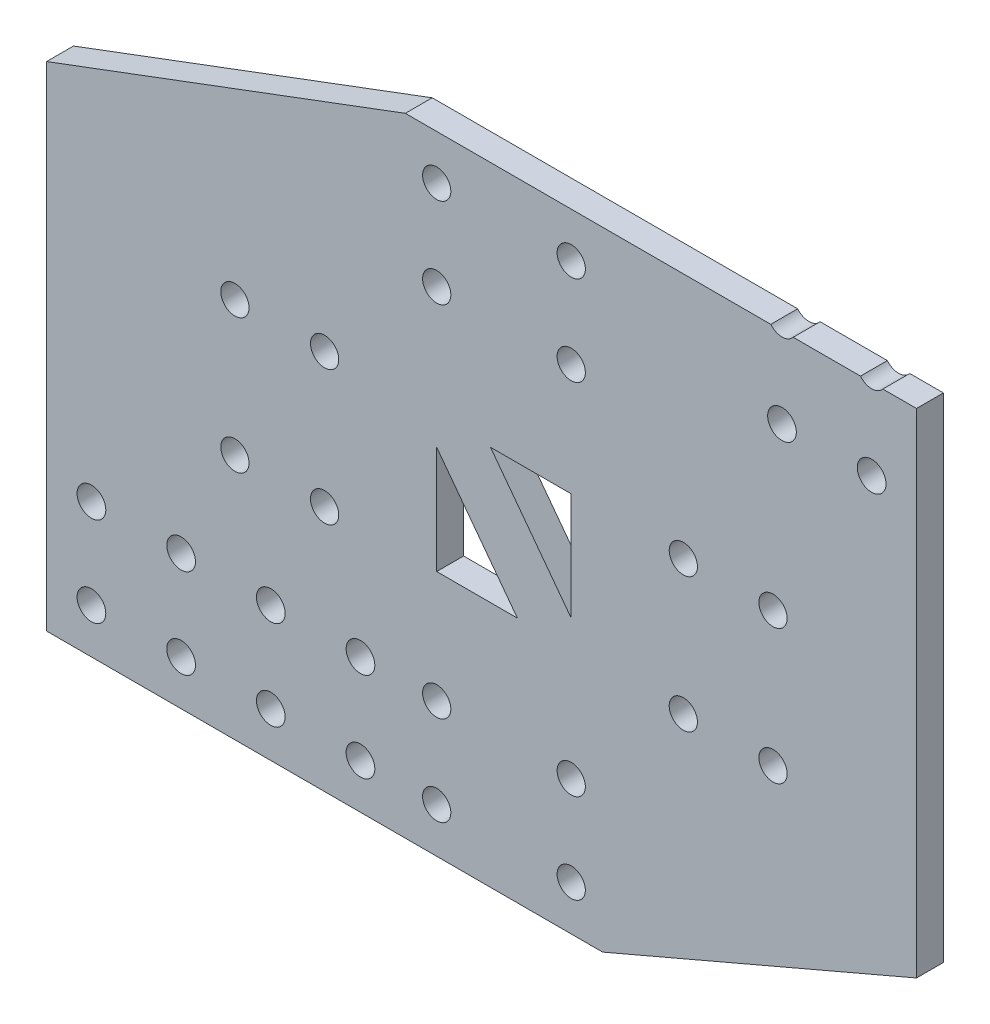
from build123d import *

# Parameters (mm, degrees)
EXTRUDE_1_DEPTH     = 3
SKETCH_2_R          = 1.575
SKETCH_2_R_2        = 1.6
CUT_EXTRUDE_1_DEPTH = 91.321647461


with BuildPart() as part:
    # 草图1 → 凸台-拉伸1 (new body)
    with BuildSketch(Plane.XY):
        Polygon((0, 0), (22, 0), (57, 0), (57, -15), (57, -55), (22, -70), (0, -70), (-40, -70), (-40, -55), (-40, -15), align=None)
    extrude(amount=EXTRUDE_1_DEPTH)

    # 草图2 → 切除-拉伸1 (cut, through all)
    with BuildSketch(Plane.XY.offset(3)):
        with Locations((18.5, -5)):
            Circle(SKETCH_2_R)
        with Locations(Location((18.5, -15, 0), (0, 0, 180))):
            Circle(SKETCH_2_R)
        with Locations((3.5, -15)):
            Circle(SKETCH_2_R)
        with Locations(Location((3.5, -5, 0), (0, 0, 180))):
            Circle(SKETCH_2_R)
        with Locations((3.5, -65)):
            Circle(SKETCH_2_R)
        with Locations(Location((3.5, -55, 0), (0, 0, 180))):
            Circle(SKETCH_2_R)
        with Locations((18.5, -55)):
            Circle(SKETCH_2_R)
        with Locations(Location((18.5, -65, 0), (0, 0, 180))):
            Circle(SKETCH_2_R)
        with Locations((-19, -42.5)):
            Circle(SKETCH_2_R)
        with Locations(Location((-19, -27.5, 0), (0, 0, 180))):
            Circle(SKETCH_2_R)
        with Locations(Location((-9, -42.5, 0), (0, 0, 180))):
            Circle(SKETCH_2_R)
        with Locations((-9, -27.5)):
            Circle(SKETCH_2_R)
        with Locations((31, -42.5)):
            Circle(SKETCH_2_R)
        with Locations(Location((41, -42.5, 0), (0, 0, 180))):
            Circle(SKETCH_2_R)
        with Locations((41, -27.5)):
            Circle(SKETCH_2_R)
        with Locations(Location((31, -27.5, 0), (0, 0, 180))):
            Circle(SKETCH_2_R)
        with Locations((-35, -65)):
            Circle(SKETCH_2_R_2)
        with Locations(Location((-25, -65, 0), (0, 0, 180))):
            Circle(SKETCH_2_R_2)
        with Locations((-25, -55)):
            Circle(SKETCH_2_R_2)
        with Locations(Location((-35, -55, 0), (0, 0, 180))):
            Circle(SKETCH_2_R_2)
        with Locations((-5, -55)):
            Circle(SKETCH_2_R_2)
        with Locations(Location((-15, -55, 0), (0, 0, 180))):
            Circle(SKETCH_2_R_2)
        with Locations((-15, -65)):
            Circle(SKETCH_2_R_2)
        with Locations(Location((-5, -65, 0), (0, 0, 180))):
            Circle(SKETCH_2_R_2)
        with Locations((52, 1)):
            Circle(SKETCH_2_R_2)
        with Locations((42, 1)):
            Circle(SKETCH_2_R_2)
        with Locations(Location((52, -9, 0), (0, 0, 180))):
            Circle(SKETCH_2_R_2)
        with Locations((42, -9)):
            Circle(SKETCH_2_R_2)
        Polygon((3.5, -30.5), (3.5, -42.5), (12.5, -42.5), align=None)
        Polygon((9.5, -27.5), (18.5, -39.5), (18.5, -27.5), align=None)
    extrude(amount=-CUT_EXTRUDE_1_DEPTH, mode=Mode.SUBTRACT)


solid = part.part
